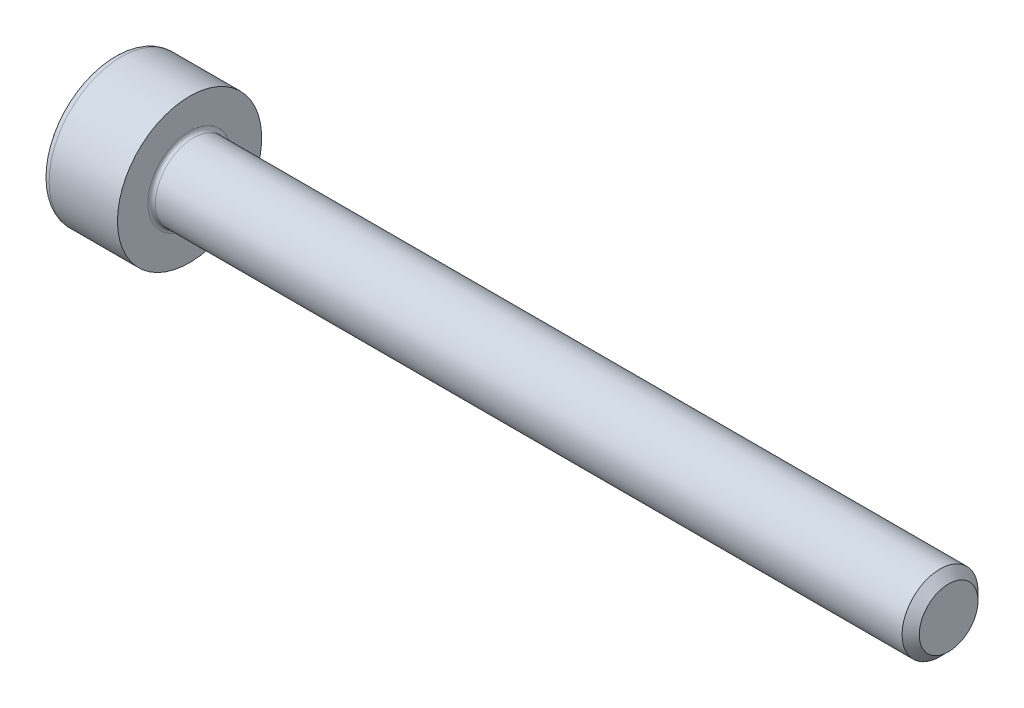
from build123d import *

# Parameters (mm, degrees)
FILLET1_R   = 0.1
FILLET2_R   = 0.2
HEX_2_DEPTH = 1


with BuildPart() as part:
    # BodySke → Base-Revolve (revolve)
    with BuildSketch(Plane.XY, mode=Mode.PRIVATE) as base_revolve_sk:
        Polygon((0, 0), (0, 1.9), (2, 1.9), (2, 1), (21.774, 1), (22, 0.774), (22, 0), align=None)
    revolve(base_revolve_sk.sketch.rotate(Axis((-31.75, 0, 0), (1, 0, 0)), 90), axis=Axis((-31.75, 0, 0), (1, 0, 0)))

    # Fillet1
    fillet1_edges = [part.edges().sort_by_distance(p)[0] for p in [
        (2, 0, -1),
    ]]
    fillet(fillet1_edges, radius=FILLET1_R)

    # Fillet2
    fillet2_edges = [part.edges().sort_by_distance(p)[0] for p in [
        (0, 0, -1.9),
    ]]
    fillet(fillet2_edges, radius=FILLET2_R)

    # Sketch2 → Hex-PreBroach (revolve, cut)
    with BuildSketch(Plane.XY, mode=Mode.PRIVATE) as hex_prebroach_sk:
        Polygon((0, 0.76), (1, 0.76), (1.438786205, 0), (0, 0), align=None)
    revolve(hex_prebroach_sk.sketch.rotate(Axis((0, 0, 0), (1, 0, 0)), 90), axis=Axis((0, 0, 0), (1, 0, 0)), mode=Mode.SUBTRACT)

    # Sketch3 → Hex 2 (cut)
    with BuildSketch(Plane(origin=(0, 0, 0), x_dir=(0, 0.500000000000001, 0.866025403784438), z_dir=(-1, 0, 0))):
        Polygon((0.438786205, 0.76), (-0.438786205, 0.76), (-0.877572409, 0), (-0.438786205, -0.76), (0.438786205, -0.76), (0.877572409, 0), align=None)
    extrude(amount=-HEX_2_DEPTH, mode=Mode.SUBTRACT)


solid = part.part
